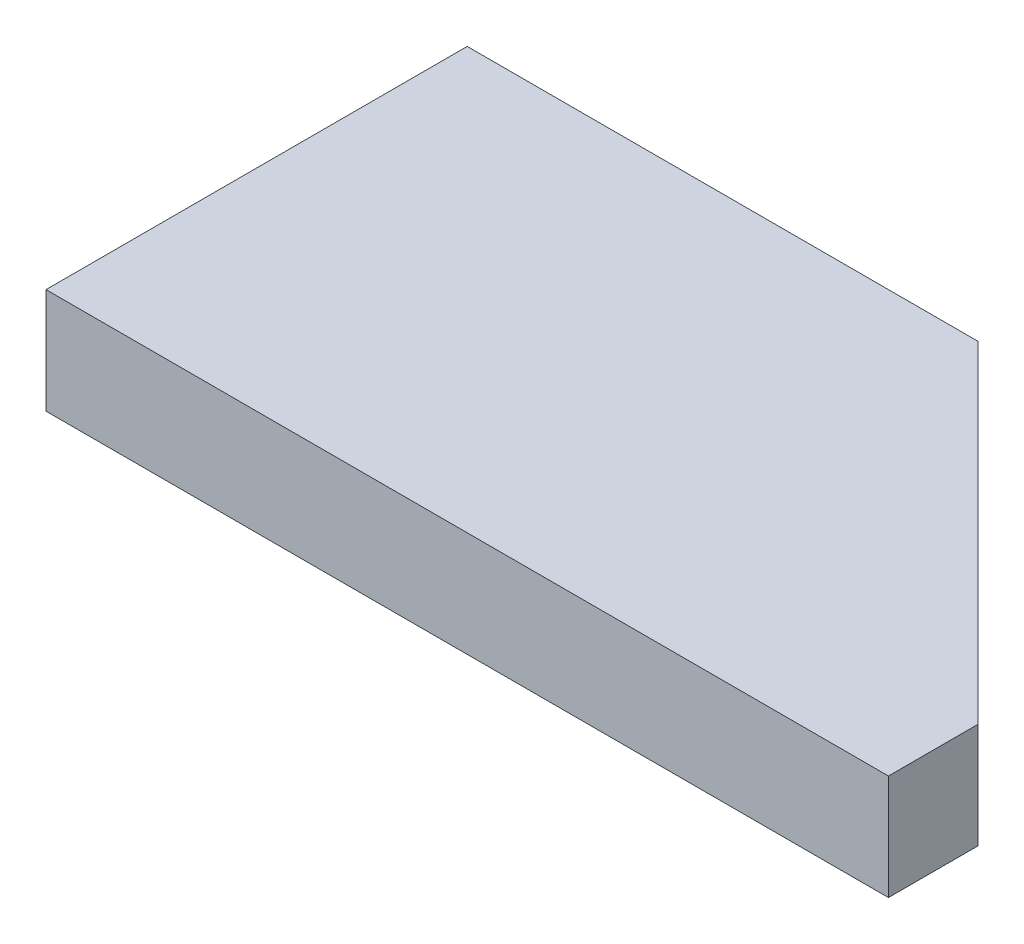
from build123d import *

# Parameters (mm, degrees)
SKETCH1_W           = 25.4
SKETCH1_H           = 12.7
BOSS_EXTRUDE1_DEPTH = 3.175
CHAMFER1_SIZE       = 10


with BuildPart() as part:
    # Sketch1 → Boss-Extrude1 (new body)
    with BuildSketch(Plane(origin=(0, 0, 0), x_dir=(1, 0, 0), z_dir=(0, 1, 0))):
        with Locations((12.7, 6.35)):
            Rectangle(SKETCH1_W, SKETCH1_H)
    extrude(amount=BOSS_EXTRUDE1_DEPTH)

    # Chamfer1
    chamfer1_edges = [part.edges().sort_by_distance(p)[0] for p in [
        (25.4, 1.5875, -12.7),
    ]]
    chamfer(chamfer1_edges, length=CHAMFER1_SIZE)


solid = part.part
